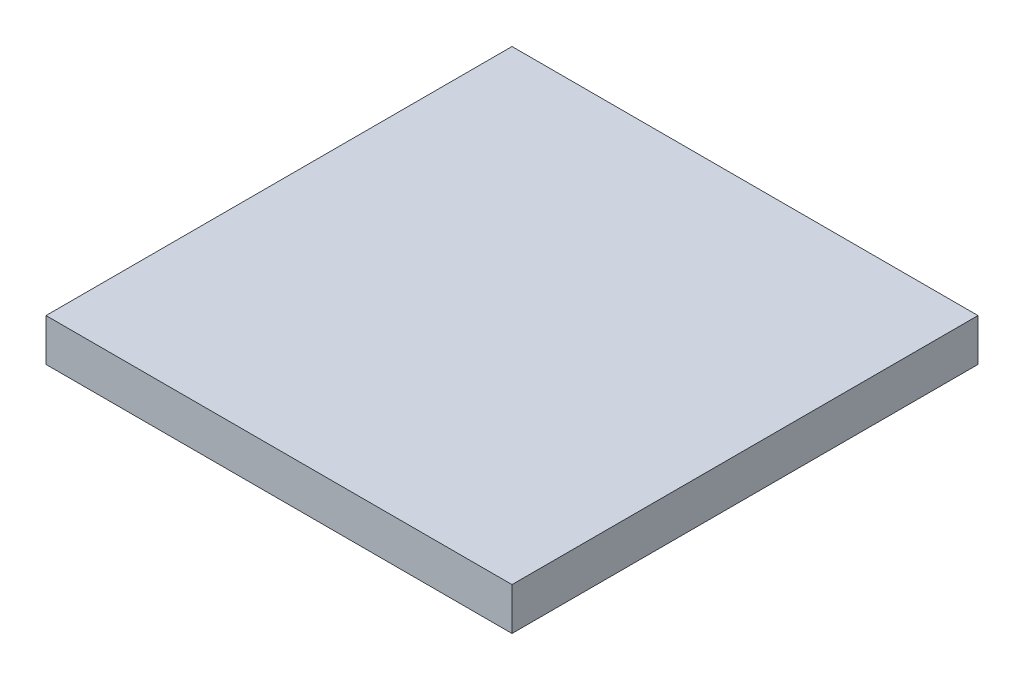
from build123d import *

# Parameters (mm, degrees)
SKETCH1_W           = 22
SKETCH1_H           = 22
BOSS_EXTRUDE1_DEPTH = 1
BOSS_EXTRUDE2_DEPTH = 2


with BuildPart() as part:
    # Sketch1 → Boss-Extrude1 (new, symmetric)
    with BuildSketch(Plane(origin=(0, 0, 0), x_dir=(1, 0, 0), z_dir=(0, 1, 0))):
        Rectangle(SKETCH1_W, SKETCH1_H)
    extrude(amount=BOSS_EXTRUDE1_DEPTH, both=True)

    # Sketch2 → Boss-Extrude2 (add)
    with BuildSketch(Plane.XZ.offset(1)):
        Polygon((-7.25, 7.25), (-7.25, 8.75), (-8.75, 8.75), (-8.75, -8.75), (8.75, -8.75), (8.75, 8.75), (7.25, 8.75), (7.25, 7.25), (7.25, -7.25), (-7.25, -7.25), align=None)
    extrude(amount=BOSS_EXTRUDE2_DEPTH)


solid = part.part
